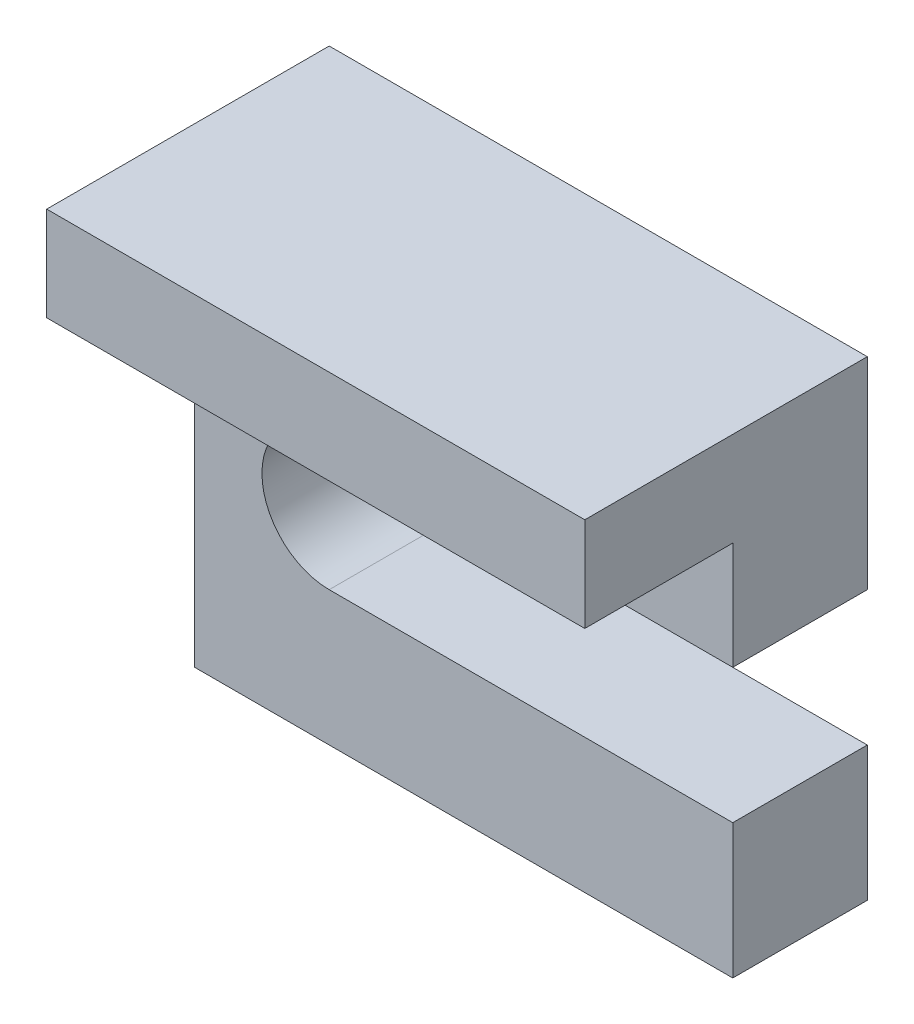
from build123d import *

# Parameters (mm, degrees)
BOSS_EXTRUDE1_DEPTH      = 20
BOSS_EXTRUDE1_DEPTH_BACK = 20
CUT_EXTRUDE1_DEPTH       = 32.020154738
CUT_EXTRUDE1_DEPTH_BACK  = 32.020154738


with BuildPart() as part:
    # Sketch1 → Boss-Extrude1 (new, two sides: drawn at the far end of the back side and taken through both)
    with BuildSketch(Plane(origin=(0, 0, 0), x_dir=(0, 0, -1), z_dir=(1, 0, 0)).offset(-BOSS_EXTRUDE1_DEPTH_BACK)):
        Polygon((-16, 17.5), (5, 17.5), (5, -17.5), (-5, -17.5), (-5, 10.5), (-16, 10.5), align=None)
    extrude(amount=BOSS_EXTRUDE1_DEPTH + BOSS_EXTRUDE1_DEPTH_BACK)

    # Sketch2 → Cut-Extrude1 (cut, two sides: drawn at the far end of the back side and taken through both)
    with BuildSketch(Plane.XY.offset(-CUT_EXTRUDE1_DEPTH_BACK)):
        with BuildLine():
            Line((20, 2.5), (-10, 2.5))
            ThreePointArc((-10, 2.5), (-15, -2.5), (-10, -7.5))
            Line((-10, -7.5), (20, -7.5))
            Line((20, -7.5), (20, 2.5))
        make_face()
    extrude(amount=CUT_EXTRUDE1_DEPTH + CUT_EXTRUDE1_DEPTH_BACK, mode=Mode.SUBTRACT)


solid = part.part
